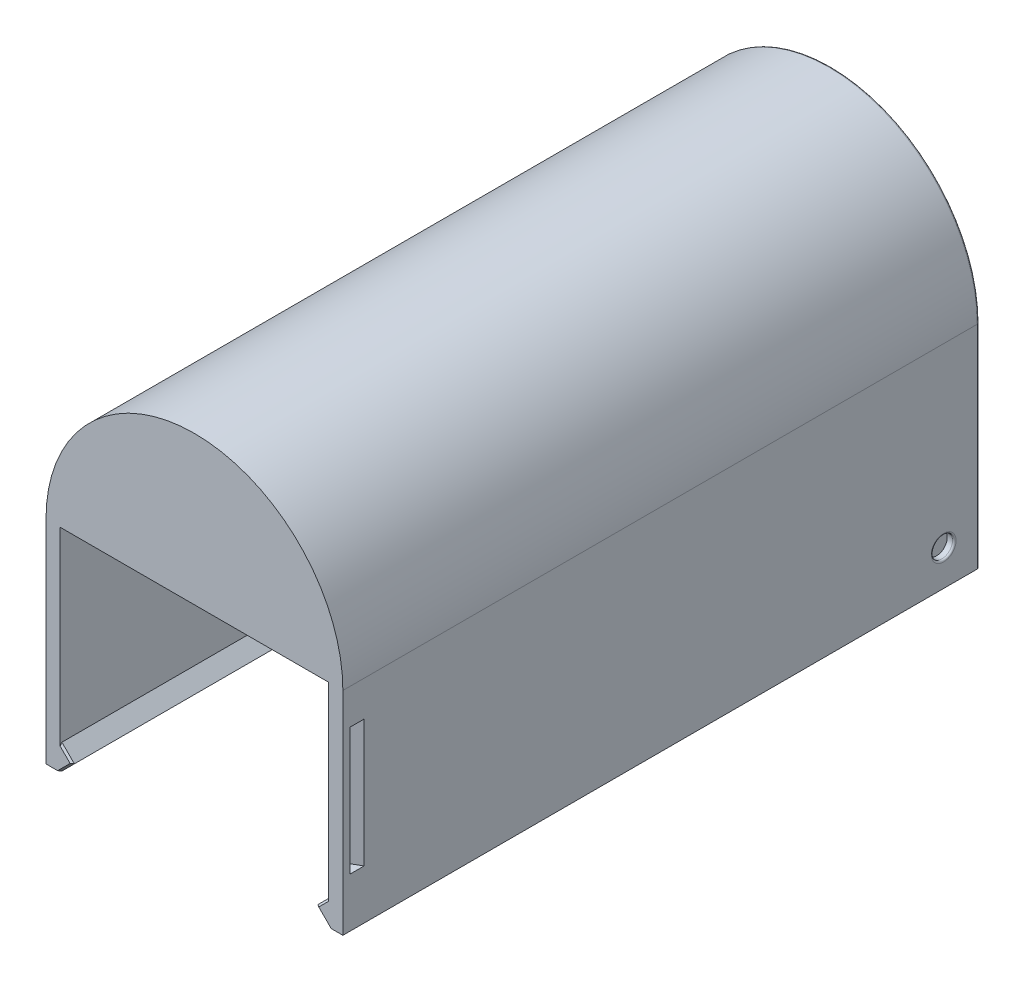
from build123d import *

# Parameters (mm, degrees)
BOSS_EXTRUDE1_DEPTH = 90
BOSS_EXTRUDE2_START = -1
BOSS_EXTRUDE2_DEPTH = 1
CUT_EXTRUDE2_DEPTH  = 2
SKETCH6_R           = 1.5
CUT_EXTRUDE3_DEPTH  = 1
CUT_EXTRUDE4_DEPTH  = 18
BOSS_EXTRUDE3_DEPTH = 78
BOSS_EXTRUDE4_START = -8
BOSS_EXTRUDE4_DEPTH = 6
FILLET2_R           = 0.25
CHAMFER1_SIZE       = 0.25
FILLET3_R           = 0.25
CHAMFER2_SIZE       = 0.25


with BuildPart() as part:
    # Sketch2 → Boss-Extrude1 (new body)
    with BuildSketch(Plane.XY):
        with BuildLine():
            Line((0, 0), (0, 30))
            ThreePointArc((0, 30), (21, 51), (42, 30))
            Line((42, 30), (42, 0))
            Line((42, 0), (40, 0))
            Line((40, 0), (40, 30))
            ThreePointArc((40, 30), (21, 49), (2, 30))
            Line((2, 30), (2, 0))
            Line((2, 0), (0, 0))
        make_face()
    extrude(amount=BOSS_EXTRUDE1_DEPTH)

    # Sketch3 → Boss-Extrude2 (add)
    with BuildSketch(Plane.XY.offset(90).offset(BOSS_EXTRUDE2_START)):
        with BuildLine():
            Line((2, 30), (40, 30))
            ThreePointArc((40, 30), (21, 49), (2, 30))
        make_face()
    extrude(amount=BOSS_EXTRUDE2_DEPTH)

    # Sketch5 → Cut-Extrude2 (cut)
    with BuildSketch(Plane.ZY):
        with BuildLine():
            Line((20.5, 23), (24.5, 23))
            ThreePointArc((24.5, 23), (30, 17.5), (24.5, 12))
            Line((24.5, 12), (20.5, 12))
            ThreePointArc((20.5, 12), (15, 17.5), (20.5, 23))
        make_face()
    extrude(amount=-CUT_EXTRUDE2_DEPTH, mode=Mode.SUBTRACT)

    # Sketch6 → Cut-Extrude3 (cut)
    with BuildSketch(Plane.ZY):
        with Locations((5, 5)):
            Circle(SKETCH6_R)
    cut_extrude3 = extrude(amount=-CUT_EXTRUDE3_DEPTH, mode=Mode.SUBTRACT)

    # Mirror1: Cut-Extrude3 across plane
    add(cut_extrude3.mirror(Plane(origin=(21, 0, 0), x_dir=(0, 0, 1), z_dir=(1, 0, 0))), mode=Mode.SUBTRACT)

    # Sketch7 → Cut-Extrude4 (cut)
    with BuildSketch(Plane(origin=(0, 7, 0), x_dir=(-1, 0, 0), z_dir=(0, -1, 0))):
        Polygon((0, -89), (0, -87), (-1.732050808, -88), align=None)
    cut_extrude4 = extrude(amount=-CUT_EXTRUDE4_DEPTH, mode=Mode.SUBTRACT)

    # Mirror2: Cut-Extrude4 across plane
    add(cut_extrude4.mirror(Plane(origin=(21, 0, 0), x_dir=(0, 0, 1), z_dir=(1, 0, 0))), mode=Mode.SUBTRACT)

    # Sketch8 → Boss-Extrude3 (add)
    with BuildSketch(Plane.XY.offset(90)):
        Polygon((2, 0), (3.767766953, 1.767766953), (2, 3.535533906), align=None)
    boss_extrude3 = extrude(amount=-BOSS_EXTRUDE3_DEPTH)

    # Mirror3: Boss-Extrude3 across plane
    add(boss_extrude3.mirror(Plane(origin=(21, 0, 0), x_dir=(0, 0, 1), z_dir=(1, 0, 0))))

    # Sketch9 → Boss-Extrude4 (add)
    with BuildSketch(Plane(origin=(0, 7, 0), x_dir=(-1, 0, 0), z_dir=(0, -1, 0)).offset(BOSS_EXTRUDE4_START)):
        Polygon((-2, -8), (-2, -14), (-4.645751311, -11), align=None)
        Polygon((-2, -39), (-2, -45), (-4.645751311, -42), align=None)
    extrude(amount=-BOSS_EXTRUDE4_DEPTH)

    # Fillet2
    fillet2_edges = [part.edges().sort_by_distance(p)[0] for p in [
        (0, 5, 3.5),
        (42, 5, 3.5),
    ]]
    fillet(fillet2_edges, radius=FILLET2_R)

    # Chamfer1
    chamfer1_edges = [part.edges().sort_by_distance(p)[0] for p in [
        (2.883883476, 2.651650429, 12),
        (2.883883476, 2.651650429, 90),
        (2.883883476, 0.883883476, 90),
        (39.116116524, 2.651650429, 90),
        (39.116116524, 0.883883476, 90),
        (39.116116524, 2.651650429, 12),
    ]]
    chamfer(chamfer1_edges, length=CHAMFER1_SIZE)

    # Fillet3
    fillet3_edges = [part.edges().sort_by_distance(p)[0] for p in [
        (0, 15, 0),
        (21, 51, 0),
        (42, 15, 0),
    ]]
    fillet(fillet3_edges, radius=FILLET3_R)

    # Chamfer2
    chamfer2_edges = [part.edges().sort_by_distance(p)[0] for p in [
        (2.795495129, 0.795495129, 12),
        (39.204504871, 0.795495129, 12),
    ]]
    chamfer(chamfer2_edges, length=CHAMFER2_SIZE)


solid = part.part
